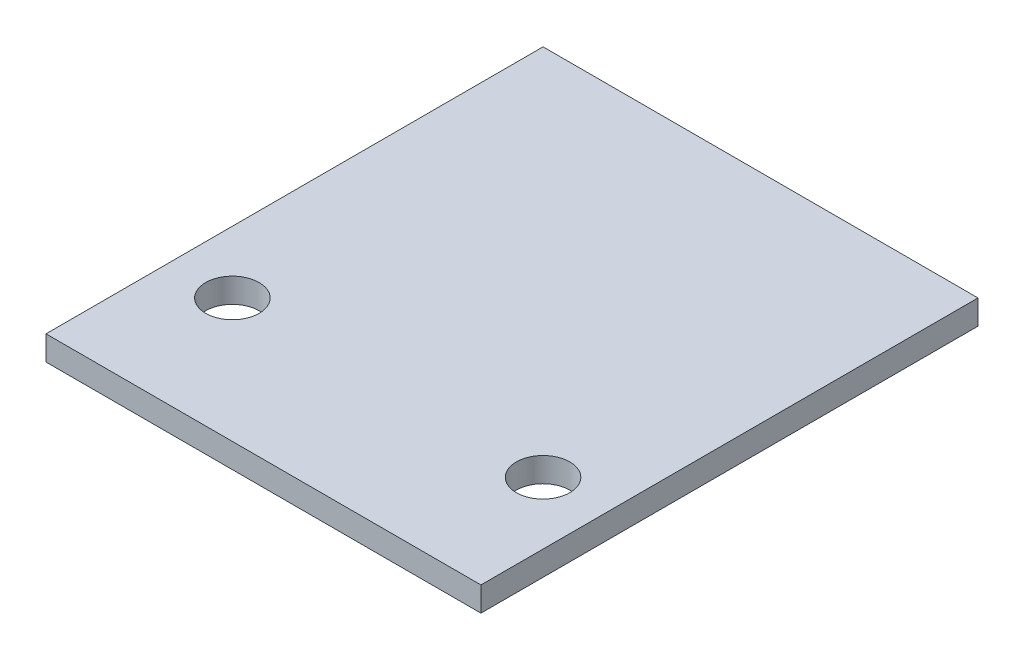
from build123d import *

# Parameters (mm, degrees)
SKETCH1_W             = 17.78
SKETCH1_H             = 20.32
BOSS_EXTRUDE1_DEPTH   = 1
F_2_CLEARANCE_HOLE1_D = 2.1844


with BuildPart() as part:
    # Sketch1 → Boss-Extrude1 (new body)
    with BuildSketch(Plane(origin=(0, 0, 0), x_dir=(1, 0, 0), z_dir=(0, 1, 0))):
        Rectangle(SKETCH1_W, SKETCH1_H)
    extrude(amount=BOSS_EXTRUDE1_DEPTH)

    # #2 Clearance Hole1 (through all)
    with Locations(Plane(origin=(0, 1, 0), x_dir=(1, 0, 0), z_dir=(0, 1, 0))):
        with Locations((-6.35, -5.08), (6.35, -5.08)):
            Hole(F_2_CLEARANCE_HOLE1_D / 2)


solid = part.part
